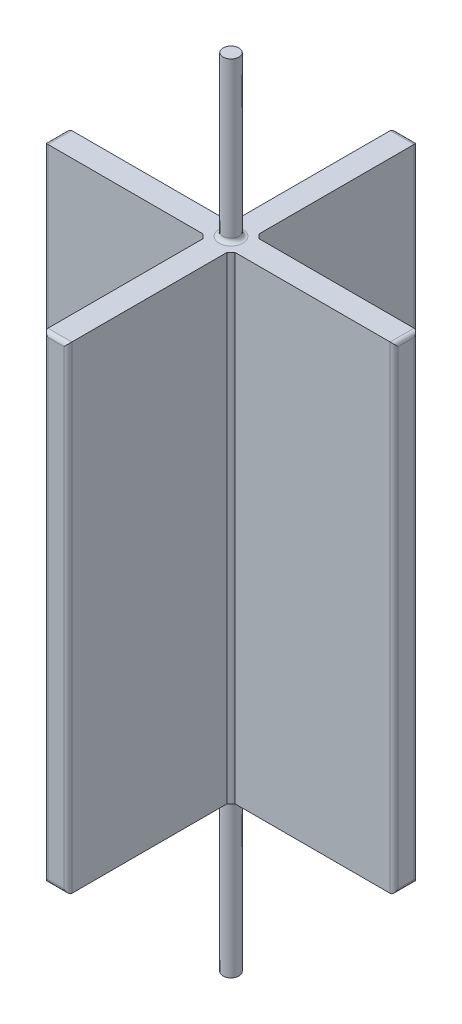
from build123d import *

# Parameters (mm, degrees)
BOSS_EXTRUDE1_DEPTH = 60
FILLET1_R           = 0.5
SKETCH3_R           = 1.000778627
CUT_EXTRUDE1_DEPTH  = 60
SKETCH4_R           = 1.000778627
BOSS_EXTRUDE2_DEPTH = 50
FILLET2_R           = 0.5


with BuildPart() as part:
    # Sketch2 → Boss-Extrude1 (new body)
    with BuildSketch(Plane(origin=(0, 0, 0), x_dir=(1, 0, 0), z_dir=(0, 1, 0))):
        with BuildLine():
            Line((22, -1.5), (22, 1.5))
            Line((22, 1.5), (2, 1.5))
            ThreePointArc((2, 1.5), (1.767766953, 1.767766953), (1.5, 2))
            Line((1.5, 2), (1.5, 22))
            Line((1.5, 22), (-1.5, 22))
            Line((-1.5, 22), (-1.5, 2))
            ThreePointArc((-1.5, 2), (-1.767766953, 1.767766953), (-2, 1.5))
            Line((-2, 1.5), (-22, 1.5))
            Line((-22, 1.5), (-22, -1.5))
            Line((-22, -1.5), (-2, -1.5))
            ThreePointArc((-2, -1.5), (-1.767766953, -1.767766953), (-1.5, -2))
            Line((-1.5, -2), (-1.5, -22))
            Line((-1.5, -22), (1.5, -22))
            Line((1.5, -22), (1.5, -2))
            ThreePointArc((1.5, -2), (1.767766953, -1.767766953), (2, -1.5))
            Line((2, -1.5), (22, -1.5))
        make_face()
    extrude(amount=BOSS_EXTRUDE1_DEPTH)

    # Fillet1
    fillet1_edges = [part.edges().sort_by_distance(p)[0] for p in [
        (22, 0, 0),
        (0, 0, 22),
        (0, 60, -22),
        (-22, 0, 0),
        (0, 0, -22),
        (22, 30, -1.5),
        (22, 30, 1.5),
        (1.5, 30, 22),
        (-1.5, 30, 22),
        (-22, 30, 1.5),
        (-22, 30, -1.5),
        (-1.5, 30, -22),
        (1.5, 30, -22),
        (-22, 60, 0),
        (0, 60, 22),
        (22, 60, 0),
    ]]
    fillet(fillet1_edges, radius=FILLET1_R)

    # Sketch3 → Cut-Extrude1 (cut)
    with BuildSketch(Plane(origin=(0, 0, 0), x_dir=(1, 0, 0), z_dir=(0, 1, 0))):
        with Locations(Location((0, 0, 0), (0, 0, 270))):
            Circle(SKETCH3_R)
    extrude(amount=CUT_EXTRUDE1_DEPTH, mode=Mode.SUBTRACT)

    # Sketch4 → Boss-Extrude2 (add, symmetric)
    with BuildSketch(Plane(origin=(0, 30, 0), x_dir=(1, 0, 0), z_dir=(0, 1, 0))):
        with Locations(Location((0, 0, 0), (0, 0, 270))):
            Circle(SKETCH4_R)
    extrude(amount=BOSS_EXTRUDE2_DEPTH, both=True)

    # Fillet2
    fillet2_edges = [part.edges().sort_by_distance(p)[0] for p in [
        (0, 60, -1.000778627),
        (0, 0, -1.000778627),
    ]]
    fillet(fillet2_edges, radius=FILLET2_R)


solid = part.part
